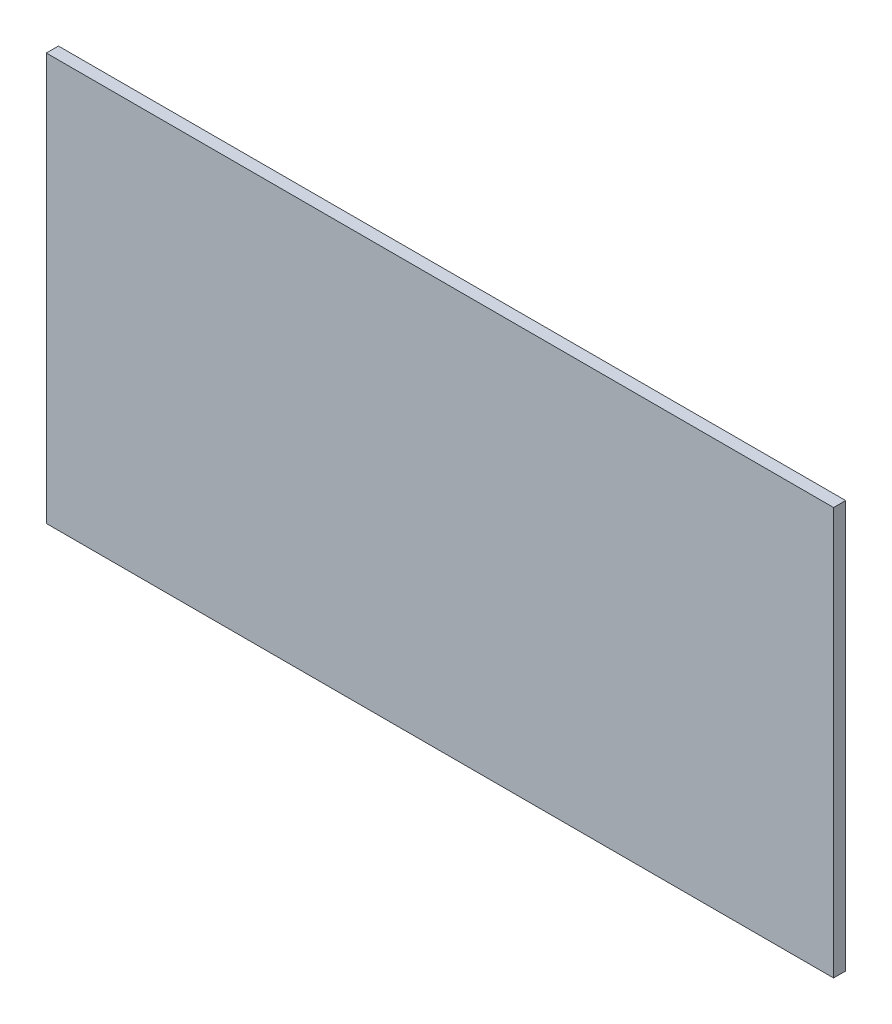
from build123d import *

# Parameters (mm, degrees)
SKETCH1_W           = 130
SKETCH1_H           = 67.28
BOSS_EXTRUDE1_DEPTH = 2


with BuildPart() as part:
    # Sketch1 → Boss-Extrude1 (new body)
    with BuildSketch(Plane.XY):
        Rectangle(SKETCH1_W, SKETCH1_H)
    extrude(amount=BOSS_EXTRUDE1_DEPTH)


solid = part.part
